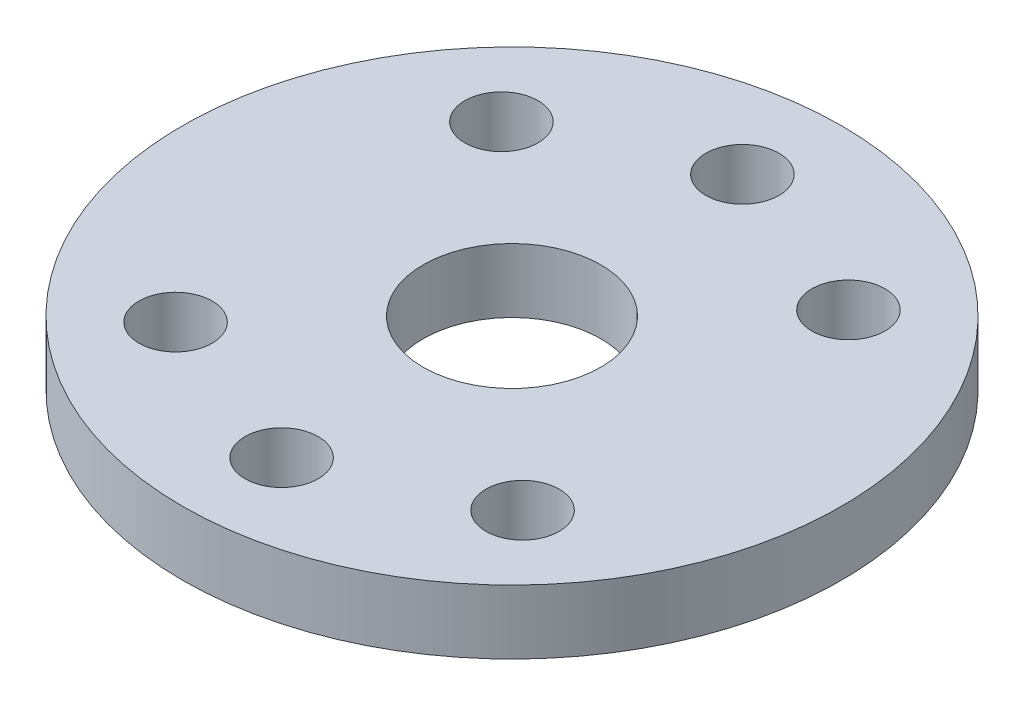
from build123d import *

# Parameters (mm, degrees)
SKETCH_1_R          = 18
SKETCH_1_R_2        = 4.85
EXTRUDE_1_DEPTH     = 3.5
SKETCH_2_R          = 2
CUT_EXTRUDE_1_DEPTH = 26.695330315


with BuildPart() as part:
    # Эскиз1 → Вытянуть1 (new body)
    with BuildSketch(Plane(origin=(0, 0, 0), x_dir=(1, 0, 0), z_dir=(0, 1, 0))):
        with Locations(Location((0, 0, 0), (0, 0, 270))):
            Circle(SKETCH_1_R)
        with Locations(Location((0, 0, 0), (0, 0, 270))):
            Circle(SKETCH_1_R_2, mode=Mode.SUBTRACT)
    extrude(amount=EXTRUDE_1_DEPTH)

    # Эскиз2 → Вырез-Вытянуть1 (cut, through all)
    with BuildSketch(Plane(origin=(0, 3.5, 0), x_dir=(1, 0, 0), z_dir=(0, 1, 0))):
        with Locations(Location((-0.408987172, 12.993564926, 0), (0, 0, 270))):
            Circle(SKETCH_2_R)
        with Locations(Location((-9.477035474, 8.898640269, 0), (0, 0, 270))):
            Circle(SKETCH_2_R)
        with Locations(Location((8.898640269, 9.477035474, 0), (0, 0, 270))):
            Circle(SKETCH_2_R)
        with Locations(Location((9.477035474, -8.898640269, 0), (0, 0, 270))):
            Circle(SKETCH_2_R)
        with Locations(Location((0.408987172, -12.993564926, 0), (0, 0, 270))):
            Circle(SKETCH_2_R)
        with Locations(Location((-8.898640269, -9.477035474, 0), (0, 0, 270))):
            Circle(SKETCH_2_R)
    extrude(amount=-CUT_EXTRUDE_1_DEPTH, mode=Mode.SUBTRACT)


solid = part.part
